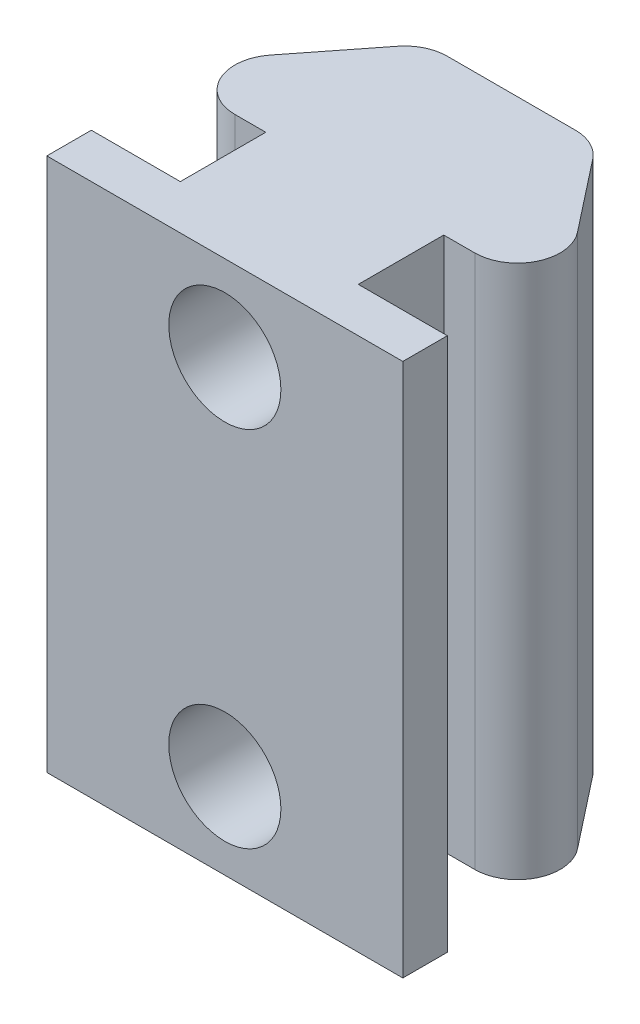
from build123d import *

# Parameters (mm, degrees)
SKETCH1_W           = 12.7
SKETCH1_H           = 19.05
BOSS_EXTRUDE1_DEPTH = 1.5875
BOSS_EXTRUDE2_DEPTH = 19.05
SKETCH4_R           = 2
CUT_EXTRUDE1_DEPTH  = 4.6355


with BuildPart() as part:
    # Sketch1 → Boss-Extrude1 (new body)
    with BuildSketch(Plane.XY):
        Rectangle(SKETCH1_W, SKETCH1_H)
    extrude(amount=BOSS_EXTRUDE1_DEPTH)

    # Sketch2 → Boss-Extrude2 (add)
    with BuildSketch(Plane(origin=(0, 9.525, 0), x_dir=(1, 0, 0), z_dir=(0, 1, 0))):
        with BuildLine():
            Line((3.175, 0), (3.175, 3.048))
            Line((3.175, 3.048), (4.281466055, 3.048))
            ThreePointArc((4.281466055, 3.048), (5.652123405, 3.905760984), (5.479872098, 5.513487629))
            Line((5.479872098, 5.513487629), (3.484406043, 8.053487629))
            ThreePointArc((3.484406043, 8.053487629), (2.952239016, 8.482657351), (2.286, 8.636))
            Line((2.286, 8.636), (-2.286, 8.636))
            ThreePointArc((-2.286, 8.636), (-2.952239016, 8.482657351), (-3.484406043, 8.053487629))
            Line((-3.484406043, 8.053487629), (-5.479872098, 5.513487629))
            ThreePointArc((-5.479872098, 5.513487629), (-5.652123405, 3.905760984), (-4.281466055, 3.048))
            Line((-4.281466055, 3.048), (-3.175, 3.048))
            Line((-3.175, 3.048), (-3.175, 0))
            Line((-3.175, 0), (3.175, 0))
        make_face()
    extrude(amount=-BOSS_EXTRUDE2_DEPTH)

    # Sketch4 → Cut-Extrude1 (cut)
    with BuildSketch(Plane.XY.offset(1.5875)):
        with Locations((0, 6.477)):
            Circle(SKETCH4_R)
        with Locations((0, -6.477)):
            Circle(SKETCH4_R)
    extrude(amount=-CUT_EXTRUDE1_DEPTH, mode=Mode.SUBTRACT)


solid = part.part
